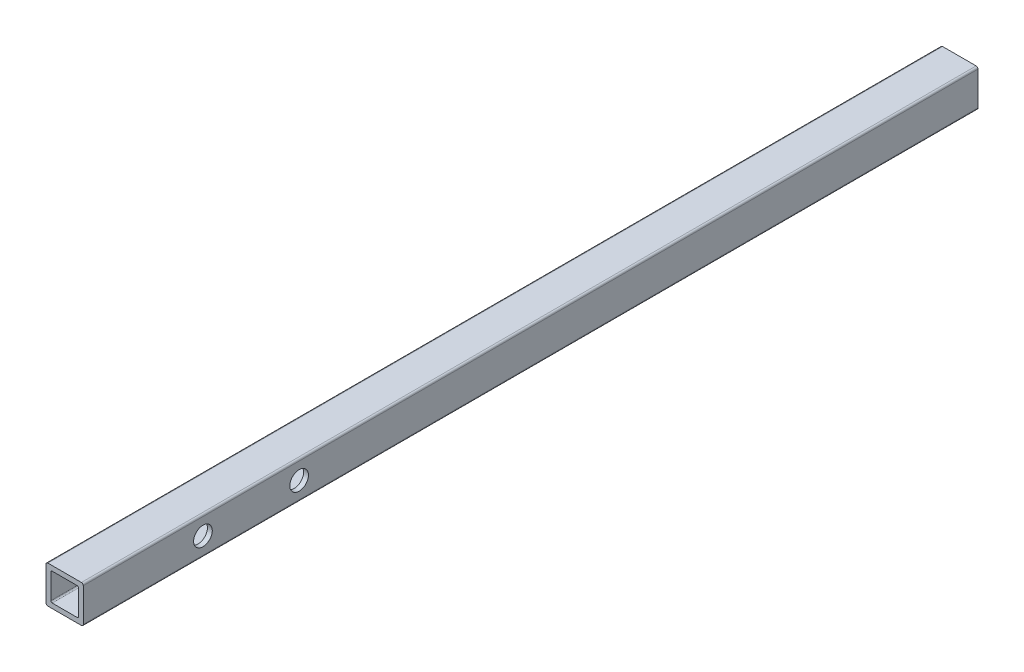
from build123d import *

# Parameters (mm, degrees)
BOSS_EXTRUDE1_DEPTH         = 152.4
BOSS_EXTRUDE1_DEPTH_BACK    = 152.4
F_1_4_0_25_DIAMETER_HOLE1_D = 6.35


with BuildPart() as part:
    # Sketch4 → Boss-Extrude1 (new, two sides: drawn at the far end of the back side and taken through both)
    with BuildSketch(Plane.XY.offset(-BOSS_EXTRUDE1_DEPTH_BACK)):
        with BuildLine():
            Line((6.35, -5.715), (6.35, 5.715))
            ThreePointArc((6.35, 5.715), (6.164012806, 6.164012806), (5.715, 6.35))
            Line((5.715, 6.35), (-5.715, 6.35))
            ThreePointArc((-5.715, 6.35), (-6.164012806, 6.164012806), (-6.35, 5.715))
            Line((-6.35, 5.715), (-6.35, -5.715))
            ThreePointArc((-6.35, -5.715), (-6.164012806, -6.164012806), (-5.715, -6.35))
            Line((-5.715, -6.35), (5.715, -6.35))
            ThreePointArc((5.715, -6.35), (6.164012806, -6.164012806), (6.35, -5.715))
        make_face()
        with BuildLine():
            Line((4.699, 4.2291), (4.699, -4.2291))
            ThreePointArc((4.699, -4.2291), (4.561369476, -4.561369476), (4.2291, -4.699))
            Line((4.2291, -4.699), (-4.2291, -4.699))
            ThreePointArc((-4.2291, -4.699), (-4.561369476, -4.561369476), (-4.699, -4.2291))
            Line((-4.699, -4.2291), (-4.699, 4.2291))
            ThreePointArc((-4.699, 4.2291), (-4.561369476, 4.561369476), (-4.2291, 4.699))
            Line((-4.2291, 4.699), (4.2291, 4.699))
            ThreePointArc((4.2291, 4.699), (4.561369476, 4.561369476), (4.699, 4.2291))
        make_face(mode=Mode.SUBTRACT)
    extrude(amount=BOSS_EXTRUDE1_DEPTH + BOSS_EXTRUDE1_DEPTH_BACK)

    # 1/4 (0.25) Diameter Hole1 (through all)
    with Locations(Plane.ZY.offset(6.35)):
        with Locations((78.867958923, 0), (111.632041077, 0)):
            Hole(F_1_4_0_25_DIAMETER_HOLE1_D / 2)


solid = part.part
